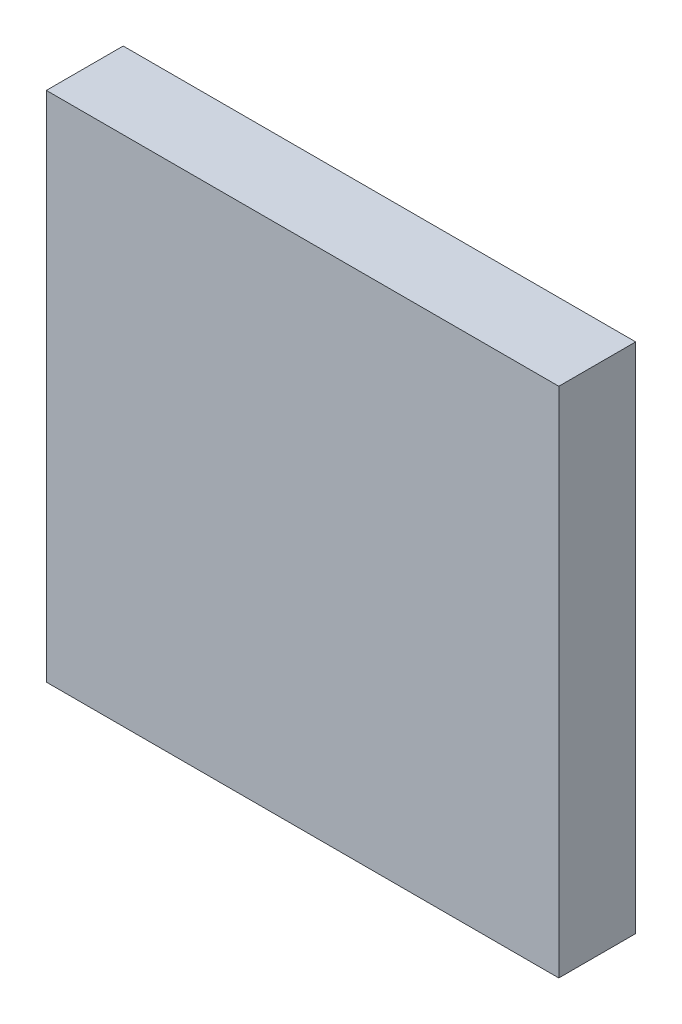
from build123d import *

# Parameters (mm, degrees)
SKETCH1_W               = 6.999986
SKETCH1_H               = 7.0000114
COMPONENT_OUTLINE_DEPTH = 1.0500106


with BuildPart() as part:
    # Sketch1 → Component_Outline (new body)
    with BuildSketch(Plane.XY):
        with Locations((0, -1.27e-05)):
            Rectangle(SKETCH1_W, SKETCH1_H)
    extrude(amount=COMPONENT_OUTLINE_DEPTH)


solid = part.part
